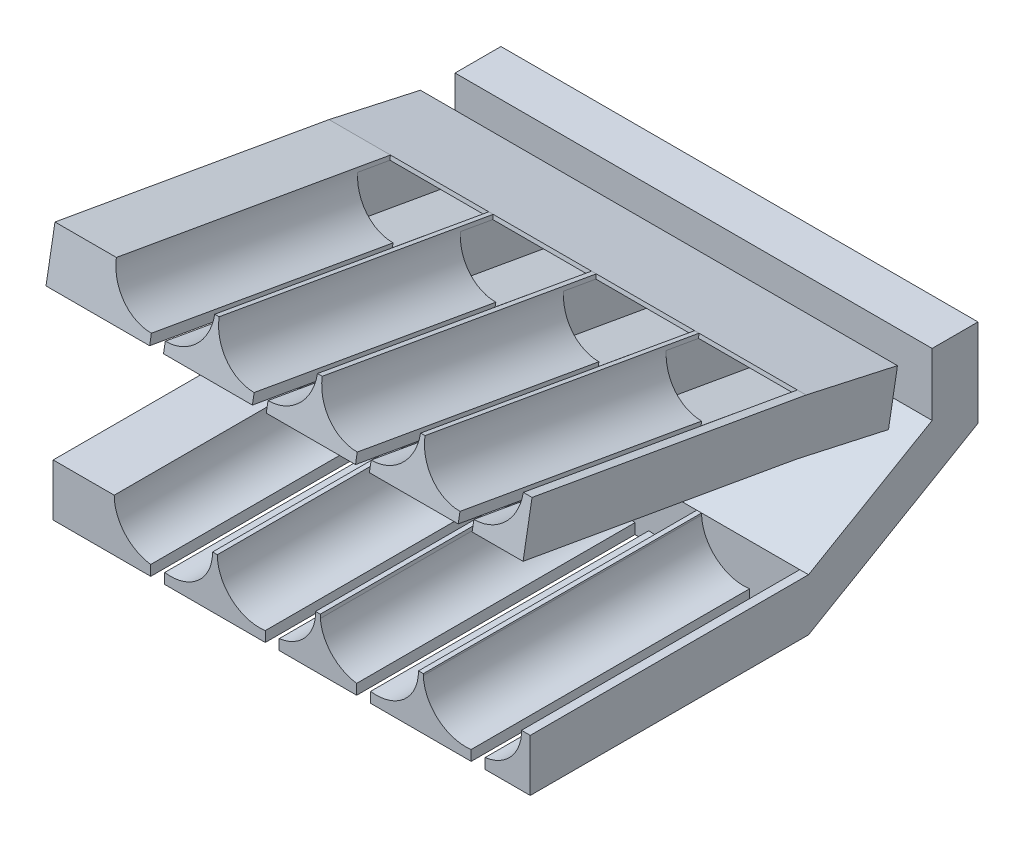
from build123d import *

# Parameters (mm, degrees)
BOSS_EXTRUDE1_DEPTH = 120
CUT_EXTRUDE4_DEPTH  = 141.624117266
BOSS_EXTRUDE4_START = -120
BOSS_EXTRUDE4_DEPTH = 120
SKETCH11_W          = 24.7
SKETCH11_H          = 10.4
CUT_EXTRUDE9_DEPTH  = 31.8
BOSS_EXTRUDE5_DEPTH = 120
SKETCH14_W          = 70
SKETCH14_H          = 13.1
BOSS_EXTRUDE6_DEPTH = 120
CUT_EXTRUDE12_DEPTH = 70


with BuildPart() as part:
    # Sketch2 → Boss-Extrude1 (new body)
    with BuildSketch(Plane(origin=(0, 0, 0), x_dir=(0, 0, -1), z_dir=(1, 0, 0))):
        Polygon((-68.936542711, 12.155372437), (-66.679116401, 24.957873226), (2.25742631, 12.802500789), (0, 0), align=None)
    extrude(amount=BOSS_EXTRUDE1_DEPTH)

    # Sketch4 → Cut-Extrude4 (cut, through all)
    with BuildSketch(Plane(origin=(0, 0, 0), x_dir=(-1, 0, 0), z_dir=(0, -0.17364817766692411, -0.9848077530122092))):
        with BuildLine():
            ThreePointArc((-103.693834735, 2.555416204), (-96.232993561, 5.591063706), (-93.072776831, 13))
            Line((-93.072776831, 13), (-117.810392147, 13))
            ThreePointArc((-117.810392147, 13), (-114.650175417, 5.591063706), (-107.189334244, 2.555416204))
            Line((-107.189334244, 2.555416204), (-107.189334244, 0))
            Line((-107.189334244, 0), (-103.693834735, 0))
            Line((-103.693834735, 0), (-103.693834735, 2.555416204))
        make_face()
        with BuildLine():
            Line((-67.228656909, 13), (-91.966272224, 13))
            ThreePointArc((-91.966272224, 13), (-88.806055495, 5.591063706), (-81.345214321, 2.555416204))
            Line((-81.345214321, 2.555416204), (-81.345214321, 0))
            Line((-81.345214321, 0), (-77.849714812, 0))
            Line((-77.849714812, 0), (-77.849714812, 2.555416204))
            ThreePointArc((-77.849714812, 2.555416204), (-70.388873638, 5.591063706), (-67.228656909, 13))
        make_face()
        with BuildLine():
            Line((-41.291041594, 13), (-66.028656909, 13))
            ThreePointArc((-66.028656909, 13), (-62.86844018, 5.591063706), (-55.407599006, 2.555416204))
            Line((-55.407599006, 2.555416204), (-55.407599006, 0))
            Line((-55.407599006, 0), (-51.912099497, 0))
            Line((-51.912099497, 0), (-51.912099497, 2.555416204))
            ThreePointArc((-51.912099497, 2.555416204), (-44.451258323, 5.591063706), (-41.291041594, 13))
        make_face()
        with BuildLine():
            Line((-15.446921672, 13), (-40.184536987, 13))
            ThreePointArc((-40.184536987, 13), (-37.024320257, 5.591063706), (-29.563479084, 2.555416204))
            Line((-29.563479084, 2.555416204), (-29.563479084, 0))
            Line((-29.563479084, 0), (-26.067979575, 0))
            Line((-26.067979575, 0), (-26.067979575, 2.555416204))
            ThreePointArc((-26.067979575, 2.555416204), (-18.607138401, 5.591063706), (-15.446921672, 13))
        make_face()
    extrude(amount=-CUT_EXTRUDE4_DEPTH, mode=Mode.SUBTRACT)


with BuildPart() as cut_extrude4_piece_1:
    # of the separate pieces the step leaves, piece 1, a body of its own (cut_extrude4_pieces)
    add(part.part.solids().sort_by_distance((0, 12.155372437, 68.936542711))[0])



with BuildPart() as cut_extrude4_piece_2:
    # of the separate pieces the step leaves, piece 2, a body of its own (cut_extrude4_pieces)
    add(part.part.solids().sort_by_distance((55.407599006, 12.155372437, 68.936542711))[0])


with BuildPart() as cut_extrude4_piece_3:
    # of the separate pieces the step leaves, piece 3, a body of its own (cut_extrude4_pieces)
    add(part.part.solids().sort_by_distance((81.345214321, 12.155372437, 68.936542711))[0])


with BuildPart() as cut_extrude4_piece_4:
    # of the separate pieces the step leaves, piece 4, a body of its own (cut_extrude4_pieces)
    add(part.part.solids().sort_by_distance((29.563479084, 12.155372437, 68.936542711))[0])


with BuildPart() as cut_extrude4_piece_5:
    # of the separate pieces the step leaves, piece 5, a body of its own (cut_extrude4_pieces)
    add(part.part.solids().sort_by_distance((107.189334244, 12.155372437, 68.936542711))[0])


with BuildPart() as cut_extrude4_piece_1_1:
    add(cut_extrude4_piece_1.part)

    add(cut_extrude4_piece_2.part)  # Boss-Extrude4 merges Cut-Extrude4 piece 2

    add(cut_extrude4_piece_3.part)  # Boss-Extrude4 merges Cut-Extrude4 piece 3

    add(cut_extrude4_piece_4.part)  # Boss-Extrude4 merges Cut-Extrude4 piece 4

    add(cut_extrude4_piece_5.part)  # Boss-Extrude4 merges Cut-Extrude4 piece 5
    # Sketch5 → Boss-Extrude4 (add)
    with BuildSketch(Plane(origin=(120, 0, 0), x_dir=(0, 0, -1), z_dir=(1, 0, 0)).offset(BOSS_EXTRUDE4_START)):
        Polygon((0, 0), (22.987385459, -5.096513818), (25.244811769, 7.705986971), (2.25742631, 12.802500789), align=None)
    extrude(amount=BOSS_EXTRUDE4_DEPTH)

    # Sketch11 → Cut-Extrude9 (cut)
    with BuildSketch(Plane(origin=(0, -4.08475313, -23.165786166), x_dir=(-1, 0, 0), z_dir=(0, -0.17364817766692414, -0.9848077530122092))):
        with Locations((-105.45, 6.772631273)):
            Rectangle(SKETCH11_W, SKETCH11_H)
        with Locations((-79.55, 6.772631273)):
            Rectangle(SKETCH11_W, SKETCH11_H)
        with Locations((-53.65, 6.772631273)):
            Rectangle(SKETCH11_W, SKETCH11_H)
        with Locations((-27.75, 6.772631273)):
            Rectangle(SKETCH11_W, SKETCH11_H)
    extrude(amount=-CUT_EXTRUDE9_DEPTH, mode=Mode.SUBTRACT)


with BuildPart() as body_2:
    # Sketch13 → Boss-Extrude5 (new body)
    with BuildSketch(Plane(origin=(120, 0, 0), x_dir=(0, 0, -1), z_dir=(1, 0, 0))):
        Polygon((33.958408758, 7.096334178), (33.958408758, -8.594668686), (2.872459687, -26.654124813), (2.872459687, -39.754124813), (45.500887711, -14.989038057), (45.500887711, 7.096334178), align=None)
    extrude(amount=-BOSS_EXTRUDE5_DEPTH)

    # Sketch14 → Boss-Extrude6 (add)
    with BuildSketch(Plane(origin=(120, 0, 0), x_dir=(0, 0, -1), z_dir=(1, 0, 0))):
        with Locations((-32.127540313, -33.204124813)):
            Rectangle(SKETCH14_W, SKETCH14_H)
    extrude(amount=-BOSS_EXTRUDE6_DEPTH)

    # Sketch15 → Cut-Extrude12 (cut)
    with BuildSketch(Plane.XY.offset(67.127540313)):
        with BuildLine():
            ThreePointArc((28.033260622, -37.153434464), (36.451781652, -34.648191148), (40.090826011, -26.654124813))
            Line((40.090826011, -26.654124813), (15.349014314, -26.654124813))
            ThreePointArc((15.349014314, -26.654124813), (17.969088097, -33.628809866), (24.533260622, -37.153388888))
            Line((24.533260622, -37.153388888), (24.533260622, -39.754124813))
            Line((24.533260622, -39.754124813), (28.033260622, -39.754124813))
            Line((28.033260622, -39.754124813), (28.033260622, -37.153434464))
        make_face()
        with BuildLine():
            Line((65.990826011, -27.594395238), (65.990826011, -26.654124813))
            Line((65.990826011, -26.654124813), (41.290826011, -26.654124813))
            ThreePointArc((41.290826011, -26.654124813), (44.92987037, -34.648191148), (53.348391401, -37.153434464))
            Line((53.348391401, -37.153434464), (53.348391401, -39.754124813))
            Line((53.348391401, -39.754124813), (56.848391401, -39.754124813))
            Line((56.848391401, -39.754124813), (56.848391401, -37.153388888))
            ThreePointArc((56.848391401, -37.153388888), (63.094850175, -33.976130347), (65.990826011, -27.594395238))
        make_face()
        with BuildLine():
            Line((91.890826011, -26.654124813), (67.190826011, -26.654124813))
            Line((67.190826011, -26.654124813), (67.190826011, -27.594395238))
            ThreePointArc((67.190826011, -27.594395238), (70.086801847, -33.976130347), (76.333260622, -37.153388888))
            Line((76.333260622, -37.153388888), (76.333260622, -39.754124813))
            Line((76.333260622, -39.754124813), (79.833260622, -39.754124813))
            Line((79.833260622, -39.754124813), (79.833260622, -37.153434464))
            ThreePointArc((79.833260622, -37.153434464), (88.251781652, -34.648191148), (91.890826011, -26.654124813))
        make_face()
        with BuildLine():
            Line((105.148391401, -37.153434464), (105.148391401, -39.754124813))
            Line((105.148391401, -39.754124813), (108.648391401, -39.754124813))
            Line((108.648391401, -39.754124813), (108.648391401, -37.153388888))
            ThreePointArc((108.648391401, -37.153388888), (114.932671804, -33.936379858), (117.8, -27.485042299))
            Line((117.8, -27.485042299), (117.8, -26.654124813))
            Line((117.8, -26.654124813), (93.1, -26.654124813))
            Line((93.1, -26.654124813), (93.1, -27.095037956))
            ThreePointArc((93.1, -27.095037956), (96.897671555, -34.79126513), (105.148391401, -37.153434464))
        make_face()
    extrude(amount=-CUT_EXTRUDE12_DEPTH, mode=Mode.SUBTRACT)


solid = Compound([cut_extrude4_piece_1_1.part, body_2.part])
